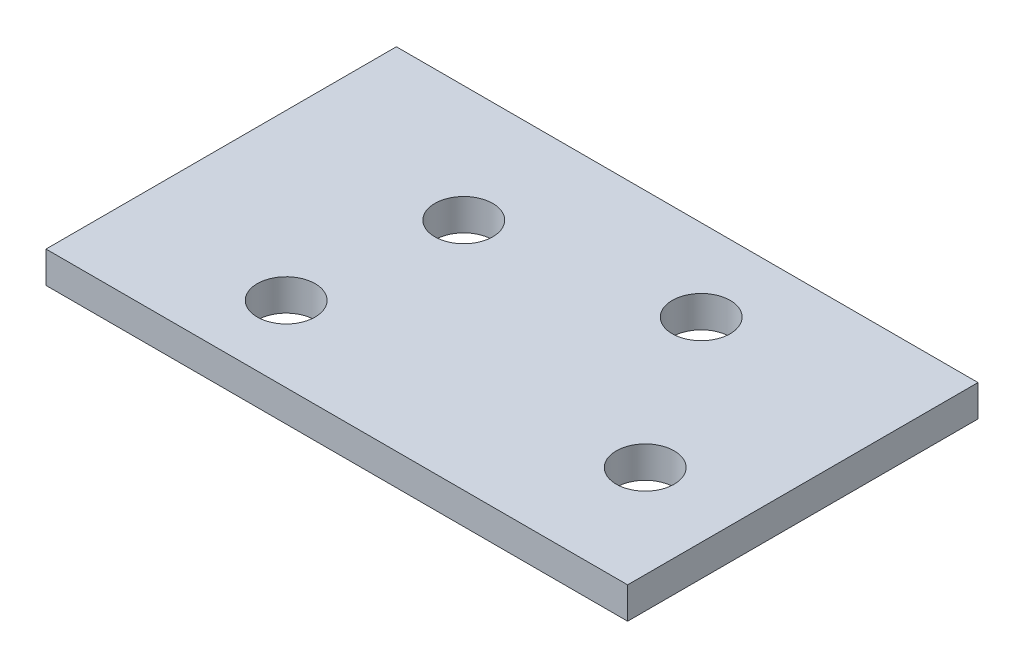
from build123d import *

# Parameters (mm, degrees)
SKETCH1_W               = 35
SKETCH1_H               = 55
SKETCH1_R               = 1.5
SKETCH1_W_2             = 1.053264104
SKETCH1_H_2             = 1.810086697
BOSS_EXTRUDE1_DEPTH     = 3
SKETCH2_W               = 30.130506089
SKETCH2_H               = 18.151203477
BOSS_EXTRUDE2_DEPTH     = 11
SKETCH4_W               = 25.972666726
SKETCH4_H               = 17.735623468
CUT_EXTRUDE2_DEPTH      = 4
CUT_EXTRUDE3_DEPTH      = 36.47534355
CUT_EXTRUDE3_DEPTH_BACK = 36.47534355
SKETCH6_R               = 1.5
CUT_EXTRUDE4_DEPTH      = 35.095454242
CUT_EXTRUDE4_DEPTH_BACK = 2.5
SKETCH7_R               = 3
SKETCH8_W               = 48.556860944
SKETCH8_H               = 13.798997775
CUT_EXTRUDE5_DEPTH      = 60.390655831


with BuildPart() as part:
    # Sketch1 → Boss-Extrude1 (new body)
    with BuildSketch(Plane(origin=(0, 0, 0), x_dir=(1, 0, 0), z_dir=(0, 1, 0))):
        Rectangle(SKETCH1_W, SKETCH1_H)
        with Locations(Location((12.5, 25, 0), (0, 0, 270))):
            Circle(SKETCH1_R, mode=Mode.SUBTRACT)
        with Locations(Location((-12.5, 25, 0), (0, 0, 270))):
            Circle(SKETCH1_R, mode=Mode.SUBTRACT)
        with Locations(Location((12.5, -25, 0), (0, 0, 270))):
            Circle(SKETCH1_R, mode=Mode.SUBTRACT)
        with Locations(Location((-12.5, -25, 0), (0, 0, 270))):
            Circle(SKETCH1_R, mode=Mode.SUBTRACT)
        with Locations((14.770586435, -21.896230663)):
            Rectangle(SKETCH1_W_2, SKETCH1_H_2, mode=Mode.SUBTRACT)
    extrude(amount=BOSS_EXTRUDE1_DEPTH)

    # Sketch2 → Boss-Extrude2 (add)
    with BuildSketch(Plane(origin=(0, 3, 0), x_dir=(1, 0, 0), z_dir=(0, 1, 0))):
        with Locations((1.371677436, 0.106547158)):
            Rectangle(SKETCH2_W, SKETCH2_H)
    extrude(amount=BOSS_EXTRUDE2_DEPTH)

    # Sketch4 → Cut-Extrude2 (cut)
    with BuildSketch(Plane.XZ):
        with Locations((1.214862274, -0.038232514)):
            Rectangle(SKETCH4_W, SKETCH4_H)
    extrude(amount=-CUT_EXTRUDE2_DEPTH, mode=Mode.SUBTRACT)

    # Sketch6 → Cut-Extrude3 (cut, two sides: drawn at the far end of the back side and taken through both)
    with BuildSketch(Plane.XZ.offset(-CUT_EXTRUDE3_DEPTH_BACK)):
        with Locations(Location((11.63, 3.25, 0), (0, 0, 270))):
            Circle(SKETCH6_R)
        with Locations(Location((-5.17, 5.05, 0), (0, 0, 270))):
            Circle(SKETCH6_R)
        with Locations(Location((-4.17, -3.15, 0), (0, 0, 270))):
            Circle(SKETCH6_R)
        with Locations(Location((6.33, -4.95, 0), (0, 0, 270))):
            Circle(SKETCH6_R)
    extrude(amount=CUT_EXTRUDE3_DEPTH + CUT_EXTRUDE3_DEPTH_BACK, mode=Mode.SUBTRACT)

    # Sketch7 → Cut-Extrude4 (cut, two sides: drawn at the far end of the back side and taken through both)
    with BuildSketch(Plane.XZ.offset(-4).offset(-CUT_EXTRUDE4_DEPTH_BACK)):
        with Locations(Location((-5.17, 5.05, 0), (0, 0, 90))):
            Circle(SKETCH7_R)
        with Locations(Location((-4.17, -3.15, 0), (0, 0, 90))):
            Circle(SKETCH7_R)
        with Locations(Location((6.33, -4.95, 0), (0, 0, 90))):
            Circle(SKETCH7_R)
        with Locations(Location((11.63, 3.25, 0), (0, 0, 31.011355011))):
            Circle(SKETCH7_R)
    extrude(amount=CUT_EXTRUDE4_DEPTH + CUT_EXTRUDE4_DEPTH_BACK, mode=Mode.SUBTRACT)

    # Sketch8 → Cut-Extrude5 (cut, through all)
    with BuildSketch(Plane.XY.offset(27.5)):
        with Locations((-0.01102719, 5.466634706)):
            Rectangle(SKETCH8_W, SKETCH8_H)
    extrude(amount=-CUT_EXTRUDE5_DEPTH, mode=Mode.SUBTRACT)


solid = part.part
